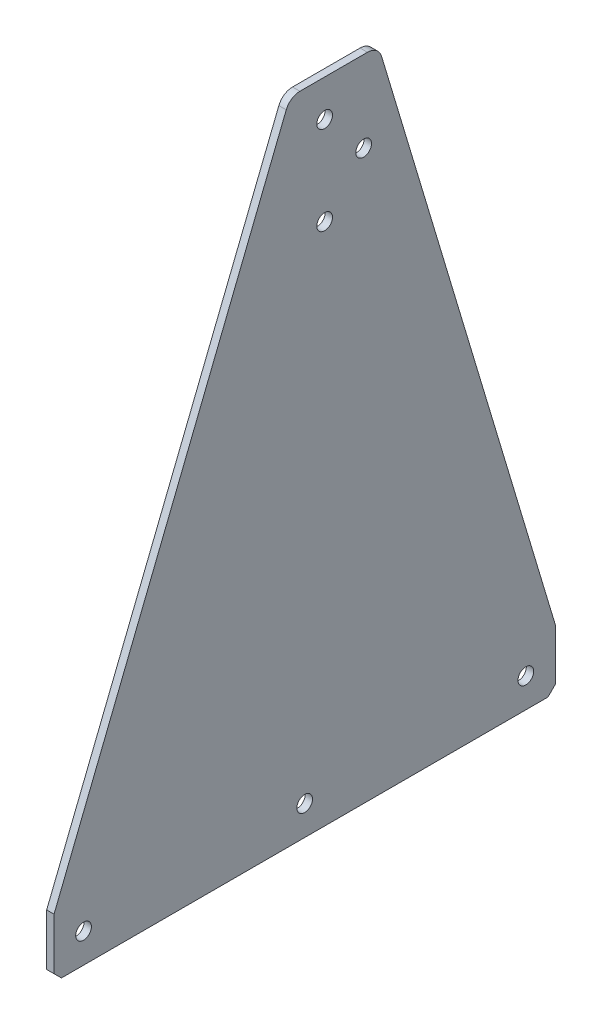
from build123d import *

# Parameters (mm, degrees)
BOSS_EXTRUDE1_DEPTH = 3.175
SKETCH3_R           = 3.3782
CUT_EXTRUDE2_DEPTH  = 354.110819184
SKETCH4_R           = 3.3782
CUT_EXTRUDE3_DEPTH  = 354.110819184
CHAMFER1_SIZE       = 3.175


with BuildPart() as part:
    # Sketch1 → Boss-Extrude1 (new body)
    with BuildSketch(Plane(origin=(0, 0, 0), x_dir=(0, 0, -1), z_dir=(1, 0, 0))):
        with BuildLine():
            Line((105.899159305, 279.4), (134.975405367, 279.4))
            ThreePointArc((134.975405367, 279.4), (138.76591423, 278.144560095), (141.057602278, 274.874659073))
            Line((141.057602278, 274.874659073), (215.9, 25.4))
            Line((215.9, 25.4), (215.9, 0))
            Line((215.9, 0), (0, 0))
            Line((0, 0), (0, 25.4))
            Line((0, 25.4), (100.003332318, 275.408330795))
            ThreePointArc((100.003332318, 275.408330795), (102.339166366, 278.308226913), (105.899159305, 279.4))
        make_face()
    extrude(amount=BOSS_EXTRUDE1_DEPTH)

    # Sketch3 → Cut-Extrude2 (cut, through all)
    with BuildSketch(Plane(origin=(3.175, 0, 0), x_dir=(0, 0, -1), z_dir=(1, 0, 0))):
        with Locations((133.35, 244.475)):
            Circle(SKETCH3_R)
        with Locations((116.549479175, 225.425)):
            Circle(SKETCH3_R)
        with Locations((116.549479175, 263.525)):
            Circle(SKETCH3_R)
    extrude(amount=-CUT_EXTRUDE2_DEPTH, mode=Mode.SUBTRACT)

    # Sketch4 → Cut-Extrude3 (cut, through all)
    with BuildSketch(Plane(origin=(3.175, 0, 0), x_dir=(0, 0, -1), z_dir=(1, 0, 0))):
        with Locations((12.7, 12.7)):
            Circle(SKETCH4_R)
        with Locations((107.95, 12.7)):
            Circle(SKETCH4_R)
        with Locations((203.2, 12.7)):
            Circle(SKETCH4_R)
    extrude(amount=-CUT_EXTRUDE3_DEPTH, mode=Mode.SUBTRACT)

    # Chamfer1
    chamfer1_edges = [part.edges().sort_by_distance(p)[0] for p in [
        (1.5875, 0, -215.9),
        (1.5875, 0, 0),
    ]]
    chamfer(chamfer1_edges, length=CHAMFER1_SIZE)


solid = part.part
